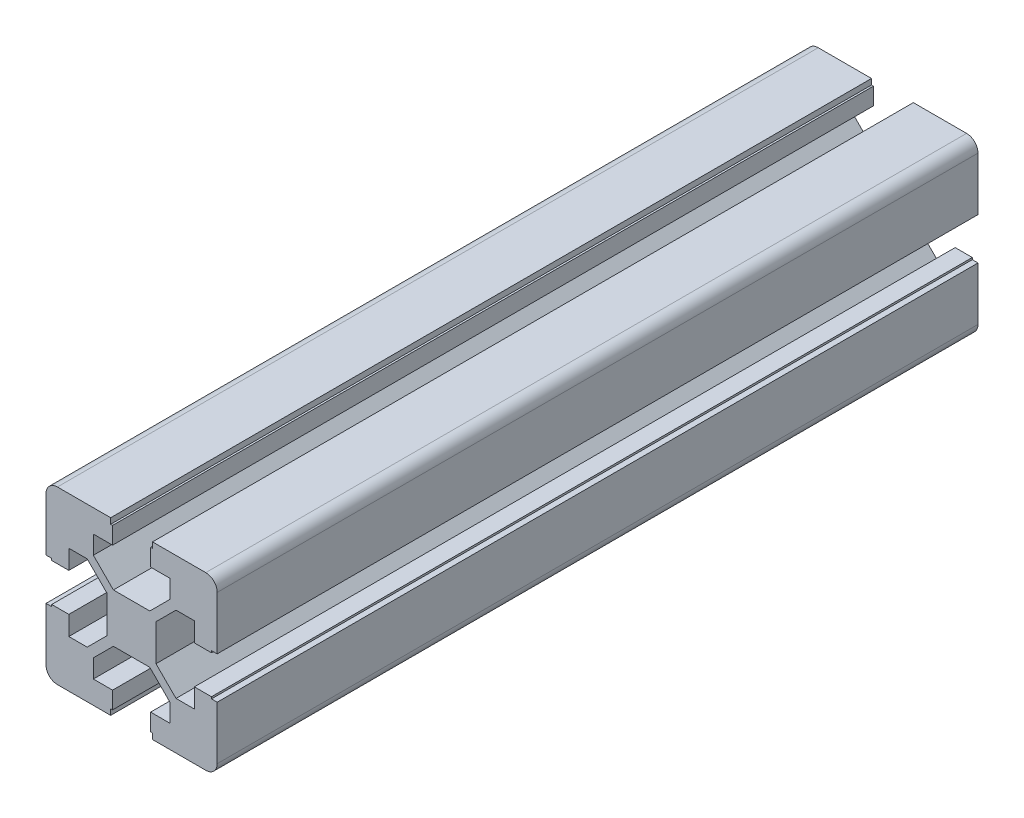
from build123d import *

# Parameters (mm, degrees)
BOSS_EXTRUDE1_DEPTH = 200


with BuildPart() as part:
    # Sketch1 → Boss-Extrude1 (new body)
    with BuildSketch(Plane.XY):
        with BuildLine():
            Line((17.715117093, 28.909882907), (12.45, 34.175))
            Line((12.45, 34.175), (12.45, 39))
            Line((12.45, 39), (17.5, 39))
            Line((17.5, 39), (17.5, 43.5))
            Line((17.5, 43.5), (17, 43.5))
            Line((17, 43.5), (17, 45))
            Line((17, 45), (3, 45))
            ThreePointArc((3, 45), (0.878679656, 44.121320344), (0, 42))
            Line((0, 42), (0, 28))
            Line((0, 28), (1.5, 28))
            Line((1.5, 28), (1.5, 27.5))
            Line((1.5, 27.5), (6, 27.5))
            Line((6, 27.5), (6, 32.55))
            Line((6, 32.55), (10.825, 32.55))
            Line((10.825, 32.55), (16.090117093, 27.284882907))
            Line((16.090117093, 27.284882907), (16.090117093, 17.715117093))
            Line((16.090117093, 17.715117093), (10.825, 12.45))
            Line((10.825, 12.45), (6, 12.45))
            Line((6, 12.45), (6, 17.5))
            Line((6, 17.5), (1.5, 17.5))
            Line((1.5, 17.5), (1.5, 17))
            Line((1.5, 17), (0, 17))
            Line((0, 17), (0, 3))
            ThreePointArc((0, 3), (0.878679656, 0.878679656), (3, 0))
            Line((3, 0), (17, 0))
            Line((17, 0), (17, 1.5))
            Line((17, 1.5), (17.5, 1.5))
            Line((17.5, 1.5), (17.5, 6))
            Line((17.5, 6), (12.45, 6))
            Line((12.45, 6), (12.45, 10.825))
            Line((12.45, 10.825), (17.715117093, 16.090117093))
            Line((17.715117093, 16.090117093), (27.284882907, 16.090117093))
            Line((27.284882907, 16.090117093), (32.55, 10.825))
            Line((32.55, 10.825), (32.55, 6))
            Line((32.55, 6), (27.5, 6))
            Line((27.5, 6), (27.5, 1.5))
            Line((27.5, 1.5), (28, 1.5))
            Line((28, 1.5), (28, 0))
            Line((28, 0), (42, 0))
            ThreePointArc((42, 0), (44.121320344, 0.878679656), (45, 3))
            Line((45, 3), (45, 17))
            Line((45, 17), (43.5, 17))
            Line((43.5, 17), (43.5, 17.5))
            Line((43.5, 17.5), (39, 17.5))
            Line((39, 17.5), (39, 12.45))
            Line((39, 12.45), (34.175, 12.45))
            Line((34.175, 12.45), (28.909882907, 17.715117093))
            Line((28.909882907, 17.715117093), (28.909882907, 27.284882907))
            Line((28.909882907, 27.284882907), (34.175, 32.55))
            Line((34.175, 32.55), (39, 32.55))
            Line((39, 32.55), (39, 27.5))
            Line((39, 27.5), (43.5, 27.5))
            Line((43.5, 27.5), (43.5, 28))
            Line((43.5, 28), (45, 28))
            Line((45, 28), (45, 42))
            ThreePointArc((45, 42), (44.121320344, 44.121320344), (42, 45))
            Line((42, 45), (28, 45))
            Line((28, 45), (28, 43.5))
            Line((28, 43.5), (27.5, 43.5))
            Line((27.5, 43.5), (27.5, 39))
            Line((27.5, 39), (32.55, 39))
            Line((32.55, 39), (32.55, 34.175))
            Line((32.55, 34.175), (27.284882907, 28.909882907))
            Line((27.284882907, 28.909882907), (17.715117093, 28.909882907))
        make_face()
    extrude(amount=BOSS_EXTRUDE1_DEPTH)


solid = part.part
